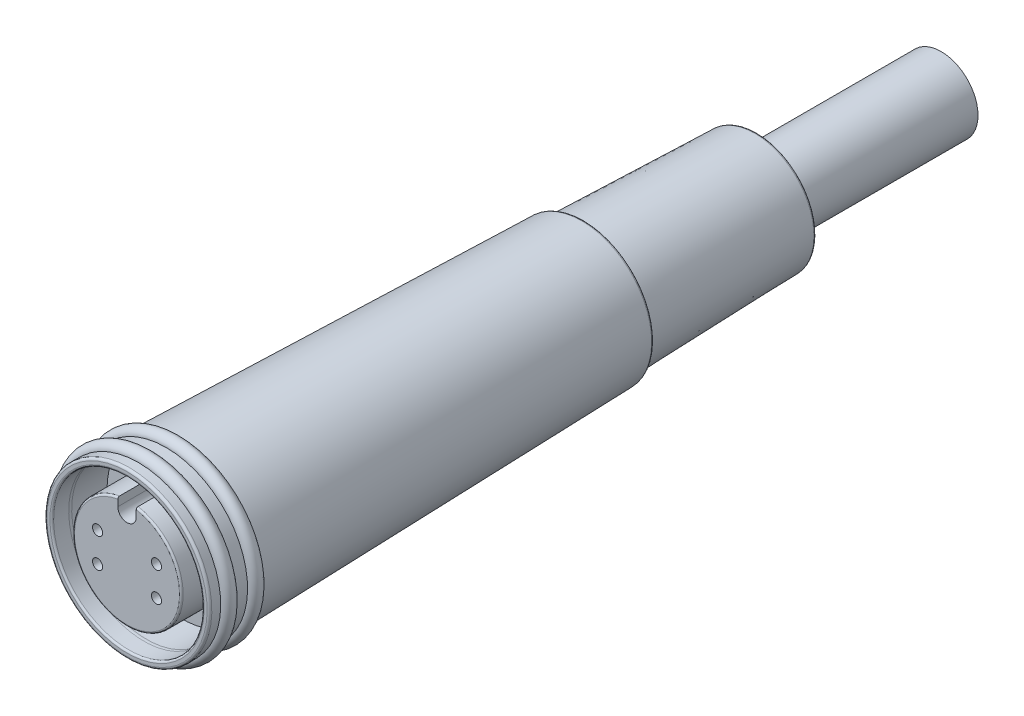
from build123d import *

# Parameters (mm, degrees)
SWEEP4_PROFILE_R   = 2
SKETCH2_R          = 0.275
CUT_EXTRUDE1_DEPTH = 3


with BuildPart() as part:
    # Sketch1 → Revolve1 (revolve)
    with BuildSketch(Plane(origin=(0, 0, 0), x_dir=(0, 0, -1), z_dir=(1, 0, 0))):
        with BuildLine():
            Line((0.625140295, 4.461465083), (0.130473635, 4.475))
            ThreePointArc((0.130473635, 4.475), (0.038434069, 4.439069905), (0, 4.348047513))
            Line((0, 4.348047513), (0, 4.185))
            ThreePointArc((0, 4.185), (0.029289322, 4.114289322), (0.1, 4.085))
            Line((0.1, 4.085), (0.919275216, 4.085))
            ThreePointArc((0.919275216, 4.085), (1, 4.076208287), (1.080724784, 4.085))
            Line((1.080724784, 4.085), (3, 4.085))
            Line((3, 4.085), (3, 2.95))
            Line((3, 2.95), (0.1, 2.95))
            ThreePointArc((0.1, 2.95), (0.029289322, 2.920710678), (0, 2.85))
            Line((0, 2.85), (0, 0))
            Line((0, 0), (34.2, 0))
            Line((34.2, 0), (34.2, 3.089917063))
            ThreePointArc((34.2, 3.089917063), (34.164162077, 3.178339208), (34.076874398, 3.216857951))
            Line((34.076874398, 3.216857951), (24.923125602, 3.496242049))
            ThreePointArc((24.923125602, 3.496242049), (24.835837923, 3.534760792), (24.8, 3.623182937))
            Line((24.8, 3.623182937), (24.8, 3.676427404))
            ThreePointArc((24.8, 3.676427404), (24.764022392, 3.764993335), (24.676473635, 3.80337989))
            Line((24.676473635, 3.80337989), (2.874859705, 4.399908952))
            ThreePointArc((2.874859705, 4.399908952), (2.510256796, 4.785025452), (2.125140295, 4.420422544))
            Line((2.125140295, 4.420422544), (1.374859705, 4.440951491))
            ThreePointArc((1.374859705, 4.440951491), (1.010256796, 4.826067991), (0.625140295, 4.461465083))
        make_face()
    revolve(axis=Axis((0, 0, -34.2), (0, 0, 1)))

    # Sweep4: sweep along a path in Sketch3
    with BuildLine(Plane(origin=(0, 0, 0), x_dir=(0, 0, -1), z_dir=(1, 0, 0))) as sweep4_path:
        Line((44.2, 0), (34.2, 0))
    # Sweep4 profile (on start of the path) → Sweep4 (sweep)
    with BuildSketch(Plane(origin=(0, 0, -44.2), x_dir=(0, 1, 0), z_dir=(0, 0, 1))):
        Circle(SWEEP4_PROFILE_R)
    sweep(path=sweep4_path.line)

    # Sketch2 → Cut-Extrude1 (cut)
    with BuildSketch(Plane.XY):
        with Locations((-1.599999975, 0.8)):
            Circle(SKETCH2_R)
        with Locations((-1.599999975, -0.8)):
            Circle(SKETCH2_R)
        with Locations(Location((1.599999975, -0.8, 0), (0, 0, 270))):
            Circle(SKETCH2_R)
        with Locations(Location((1.599999975, 0.8, 0), (0, 0, 270))):
            Circle(SKETCH2_R)
        with BuildLine():
            Line((0.5, 2.95), (0.5, 2.45))
            ThreePointArc((0.5, 2.45), (0, 1.95), (-0.5, 2.45))
            Line((-0.5, 2.45), (-0.5, 2.95))
            ThreePointArc((-0.5, 2.95), (0, 3.45), (0.5, 2.95))
        make_face()
    extrude(amount=-CUT_EXTRUDE1_DEPTH, mode=Mode.SUBTRACT)


solid = part.part
